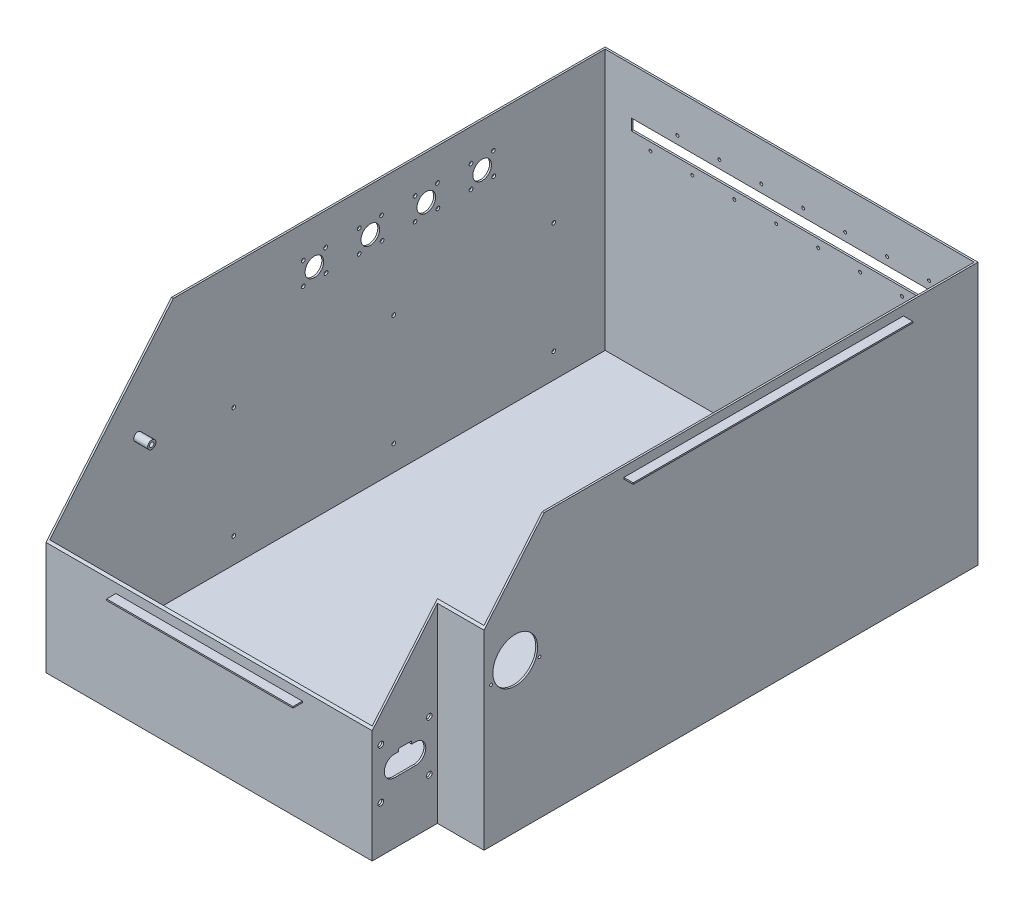
from build123d import *

# Parameters (mm, degrees)
BOSS_EXTRUDE1_DEPTH     = 1.5
BOSS_EXTRUDE2_DEPTH     = 280
SKETCH4_W               = 400
SKETCH4_H               = 42.385541564
BOSS_EXTRUDE3_DEPTH     = 2
CUT_EXTRUDE1_DEPTH      = 609.61485268
CUT_EXTRUDE1_DEPTH_BACK = 609.61485268
SKETCH8_R               = 4.39
SKETCH8_R_2             = 2.39
BOSS_EXTRUDE5_DEPTH     = 15
SKETCH10_R              = 3
CUT_EXTRUDE2_DEPTH      = 2
SKETCH5_R               = 2
SKETCH5_R_2             = 10
CUT_EXTRUDE7_DEPTH      = 2
SKETCH21_W              = 300
SKETCH21_H              = 1.5
BOSS_EXTRUDE9_DEPTH     = 10
SKETCH22_W              = 300
SKETCH22_H              = 1.5
BOSS_EXTRUDE10_DEPTH    = 10
BOSS_EXTRUDE11_DEPTH    = 0.75
BOSS_EXTRUDE12_DEPTH    = 0.75
BOSS_EXTRUDE13_DEPTH    = 0.75
BOSS_EXTRUDE14_DEPTH    = 0.75
SKETCH27_W              = 200
SKETCH27_H              = 1.5
BOSS_EXTRUDE15_DEPTH    = 10
BOSS_EXTRUDE16_DEPTH    = 0.75
BOSS_EXTRUDE17_DEPTH    = 0.75
SKETCH30_R              = 24
SKETCH30_R_2            = 1.5
CUT_EXTRUDE8_DEPTH      = 2
SKETCH33_R              = 2
CUT_EXTRUDE9_DEPTH      = 2
SKETCH42_W              = 340
SKETCH42_H              = 12
SKETCH42_R              = 1.6
CUT_EXTRUDE13_DEPTH     = 40


with BuildPart() as part:
    # Sketch1 → Boss-Extrude1 (new body)
    with BuildSketch(Plane(origin=(0, 0, 0), x_dir=(1, 0, 0), z_dir=(0, 1, 0))):
        Polygon((-200, 237.826300096), (200, 237.826300096), (200, -292.173699904), (150, -292.173699904), (150, -362.173699904), (-200, -362.173699904), align=None)
    extrude(amount=BOSS_EXTRUDE1_DEPTH)

    # Sketch2 → Boss-Extrude2 (add)
    with BuildSketch(Plane(origin=(0, 1.5, 0), x_dir=(1, 0, 0), z_dir=(0, 1, 0))):
        Polygon((-200, 237.826300096), (-200, -362.173699904), (150, -362.173699904), (150, -292.173699904), (200, -292.173699904), (200, 237.826300096), align=None)
        Polygon((-198, 235.826300096), (-198, -360.173699904), (148, -360.173699904), (148, -290.173699904), (198, -290.173699904), (198, 235.826300096), align=None, mode=Mode.SUBTRACT)
    extrude(amount=BOSS_EXTRUDE2_DEPTH)

    # Sketch4 → Boss-Extrude3 (add)
    with BuildSketch(Plane(origin=(0, 0, -237.826300096), x_dir=(-1, 0, 0), z_dir=(0, 0, -1))):
        with Locations((0, 213.483316708)):
            Rectangle(SKETCH4_W, SKETCH4_H)
    extrude(amount=-BOSS_EXTRUDE3_DEPTH)

    # Sketch3 → Cut-Extrude1 (cut, two sides: drawn at the far end of the back side and taken through both)
    with BuildSketch(Plane.ZY.offset(200).offset(-CUT_EXTRUDE1_DEPTH_BACK)):
        Polygon((362.173699904, 121.117558148), (227.596852099, 281.5), (362.173699904, 281.5), align=None)
    extrude(amount=CUT_EXTRUDE1_DEPTH + CUT_EXTRUDE1_DEPTH_BACK, mode=Mode.SUBTRACT)

    # Sketch8 → Boss-Extrude5 (add)
    # profile 1 of 2: a face of its own
    with BuildSketch(Plane(origin=(-198, 0, 0), x_dir=(0, 0, -1), z_dir=(1, 0, 0))):
        with Locations((-265.673697326, 172.19919718)):
            Circle(SKETCH8_R)
        with Locations((-265.673697326, 172.19919718)):
            Circle(SKETCH8_R_2, mode=Mode.SUBTRACT)
    # profile 2 of 2: a face of its own
    with BuildSketch(Plane(origin=(-198, 0, 0), x_dir=(0, 0, -1), z_dir=(1, 0, 0))):
        with Locations((-265.173699904, 16.5)):
            Circle(SKETCH8_R)
        with Locations((-265.173699904, 16.5)):
            Circle(SKETCH8_R_2, mode=Mode.SUBTRACT)
    extrude(amount=BOSS_EXTRUDE5_DEPTH)

    # Sketch10 → Cut-Extrude2 (cut)
    with BuildSketch(Plane.ZY.offset(-148)):
        with BuildLine():
            Line((333.923699904, 90.5), (319.923699904, 90.5))
            Line((319.923699904, 90.5), (319.923699904, 87.5))
            Line((319.923699904, 87.5), (315.673699904, 87.5))
            ThreePointArc((315.673699904, 87.5), (304.673699904, 76.5), (315.673699904, 65.5))
            Line((315.673699904, 65.5), (338.173699904, 65.5))
            ThreePointArc((338.173699904, 65.5), (349.173699904, 76.5), (338.173699904, 87.5))
            Line((338.173699904, 87.5), (333.923699904, 87.5))
            Line((333.923699904, 87.5), (333.923699904, 90.5))
        make_face()
        with Locations((300.973699904, 103.45)):
            Circle(SKETCH10_R)
        with Locations((352.873699904, 103.45)):
            Circle(SKETCH10_R)
        with Locations((300.973699904, 49.55)):
            Circle(SKETCH10_R)
        with Locations((352.873699904, 49.55)):
            Circle(SKETCH10_R)
    extrude(amount=-CUT_EXTRUDE2_DEPTH, mode=Mode.SUBTRACT)

    # Sketch5 → Cut-Extrude7 (cut)
    with BuildSketch(Plane.ZY.offset(200)):
        with Locations((-115.826300096, 247.120648807)):
            Circle(SKETCH5_R)
        with Locations((-116.326300096, 223.125857706)):
            Circle(SKETCH5_R)
        with Locations((-91.826300096, 223.120648807)):
            Circle(SKETCH5_R)
        with Locations((-91.826300096, 247.120648807)):
            Circle(SKETCH5_R)
        with Locations((-103.826300096, 235.120648807)):
            Circle(SKETCH5_R_2)
        with Locations((-55.826300096, 247.120648807)):
            Circle(SKETCH5_R)
        with Locations((-56.326300096, 223.125857706)):
            Circle(SKETCH5_R)
        with Locations((-31.826300096, 223.120648807)):
            Circle(SKETCH5_R)
        with Locations((-31.826300096, 247.120648807)):
            Circle(SKETCH5_R)
        with Locations((-43.826300096, 235.120648807)):
            Circle(SKETCH5_R_2)
        with Locations((4.173699904, 247.120648807)):
            Circle(SKETCH5_R)
        with Locations((3.673699904, 223.125857706)):
            Circle(SKETCH5_R)
        with Locations((28.173699904, 223.120648807)):
            Circle(SKETCH5_R)
        with Locations((28.173699904, 247.120648807)):
            Circle(SKETCH5_R)
        with Locations((16.173699904, 235.120648807)):
            Circle(SKETCH5_R_2)
        with Locations((64.173699904, 247.120648807)):
            Circle(SKETCH5_R)
        with Locations((63.673699904, 223.125857706)):
            Circle(SKETCH5_R)
        with Locations((88.173699904, 223.120648807)):
            Circle(SKETCH5_R)
        with Locations((88.173699904, 247.120648807)):
            Circle(SKETCH5_R)
        with Locations((76.173699904, 235.120648807)):
            Circle(SKETCH5_R_2)
    extrude(amount=-CUT_EXTRUDE7_DEPTH, mode=Mode.SUBTRACT)

    # Sketch21 → Boss-Extrude9 (add)
    with BuildSketch(Plane(origin=(0, 0, -237.826300096), x_dir=(-1, 0, 0), z_dir=(0, 0, -1))):
        with Locations((0, 270.75)):
            Rectangle(SKETCH21_W, SKETCH21_H)
    extrude(amount=BOSS_EXTRUDE9_DEPTH)

    # Sketch22 → Boss-Extrude10 (add)
    with BuildSketch(Plane.ZY.offset(200)):
        with Locations((-7.826300096, 270.75)):
            Rectangle(SKETCH22_W, SKETCH22_H)
    boss_extrude10 = extrude(amount=BOSS_EXTRUDE10_DEPTH)

    # Sketch23 → Boss-Extrude11 (add, symmetric)
    with BuildSketch(Plane(origin=(0, 0, -77.826300096), x_dir=(-1, 0, 0), z_dir=(0, 0, -1))):
        Polygon((210, 270), (200, 270), (200, 260), align=None)
    boss_extrude11 = extrude(amount=BOSS_EXTRUDE11_DEPTH, both=True)

    # Sketch24 → Boss-Extrude12 (add, symmetric)
    with BuildSketch(Plane.XY.offset(52.173699904)):
        Polygon((-210, 270), (-200, 260), (-200, 270), align=None)
    boss_extrude12 = extrude(amount=BOSS_EXTRUDE12_DEPTH, both=True)

    # Sketch25 → Boss-Extrude13 (add, symmetric)
    with BuildSketch(Plane(origin=(100, 0, 0), x_dir=(0, 0, -1), z_dir=(1, 0, 0))):
        Polygon((247.826300096, 270), (237.826300096, 270), (237.826300096, 260), align=None)
    extrude(amount=BOSS_EXTRUDE13_DEPTH, both=True)

    # Sketch26 → Boss-Extrude14 (add, symmetric)
    with BuildSketch(Plane.ZY.offset(100)):
        Polygon((-247.826300096, 270), (-237.826300096, 260), (-237.826300096, 270), align=None)
    extrude(amount=BOSS_EXTRUDE14_DEPTH, both=True)

    # Mirror1: Boss-Extrude10, Boss-Extrude11, Boss-Extrude12 across plane
    add(boss_extrude10.mirror(Plane(origin=(0, 0, 0), x_dir=(0, 0, 1), z_dir=(1, 0, 0))))
    add(boss_extrude11.mirror(Plane(origin=(0, 0, 0), x_dir=(0, 0, 1), z_dir=(1, 0, 0))))
    add(boss_extrude12.mirror(Plane(origin=(0, 0, 0), x_dir=(0, 0, 1), z_dir=(1, 0, 0))))

    # Sketch27 → Boss-Extrude15 (add)
    with BuildSketch(Plane.XY.offset(362.173699904)):
        with Locations((-25, 110.367558148)):
            Rectangle(SKETCH27_W, SKETCH27_H)
    extrude(amount=BOSS_EXTRUDE15_DEPTH)

    # Sketch28 → Boss-Extrude16 (add, symmetric)
    with BuildSketch(Plane.ZY.offset(95)):
        Polygon((372.173699904, 109.617558148), (362.173699904, 109.617558148), (362.173699904, 99.617558148), align=None)
    extrude(amount=BOSS_EXTRUDE16_DEPTH, both=True)

    # Sketch29 → Boss-Extrude17 (add, symmetric)
    with BuildSketch(Plane(origin=(45, 0, 0), x_dir=(0, 0, -1), z_dir=(1, 0, 0))):
        Polygon((-372.173699904, 109.617558148), (-362.173699904, 99.617558148), (-362.173699904, 109.617558148), align=None)
    extrude(amount=BOSS_EXTRUDE17_DEPTH, both=True)

    # Sketch30 → Cut-Extrude8 (cut)
    with BuildSketch(Plane(origin=(200, 0, 0), x_dir=(0, 0, -1), z_dir=(1, 0, 0))):
        with Locations((-258.673699904, 160)):
            Circle(SKETCH30_R)
        with Locations((-284.673699904, 150)):
            Circle(SKETCH30_R_2)
        with Locations((-232.673699904, 150)):
            Circle(SKETCH30_R_2)
    extrude(amount=-CUT_EXTRUDE8_DEPTH, mode=Mode.SUBTRACT)

    # Sketch33 → Cut-Extrude9 (cut)
    with BuildSketch(Plane.ZY.offset(200)):
        with Locations((-180.626300096, 147.77)):
            Circle(SKETCH33_R)
        with Locations((-180.626300096, 28.39)):
            Circle(SKETCH33_R)
        with Locations((-8.926300096, 147.77)):
            Circle(SKETCH33_R)
        with Locations((-8.926300096, 28.39)):
            Circle(SKETCH33_R)
        with Locations((162.773699904, 147.77)):
            Circle(SKETCH33_R)
        with Locations((162.773699904, 28.39)):
            Circle(SKETCH33_R)
    extrude(amount=-CUT_EXTRUDE9_DEPTH, mode=Mode.SUBTRACT)

    # Sketch42 → Cut-Extrude13 (cut)
    with BuildSketch(Plane.XY.offset(-235.826300096)):
        with Locations((0, 225.5)):
            Rectangle(SKETCH42_W, SKETCH42_H)
        with Locations((-120.5, 240)):
            Circle(SKETCH42_R)
        with Locations((-149.5, 211)):
            Circle(SKETCH42_R)
        with Locations((-75.5, 240)):
            Circle(SKETCH42_R)
        with Locations((-104.5, 211)):
            Circle(SKETCH42_R)
        with Locations((-30.5, 240)):
            Circle(SKETCH42_R)
        with Locations((-59.5, 211)):
            Circle(SKETCH42_R)
        with Locations((14.5, 240)):
            Circle(SKETCH42_R)
        with Locations((-14.5, 211)):
            Circle(SKETCH42_R)
        with Locations((59.5, 240)):
            Circle(SKETCH42_R)
        with Locations((30.5, 211)):
            Circle(SKETCH42_R)
        with Locations((104.5, 240)):
            Circle(SKETCH42_R)
        with Locations((75.5, 211)):
            Circle(SKETCH42_R)
        with Locations((149.5, 240)):
            Circle(SKETCH42_R)
        with Locations((120.5, 211)):
            Circle(SKETCH42_R)
    extrude(amount=-CUT_EXTRUDE13_DEPTH, mode=Mode.SUBTRACT)


solid = part.part
